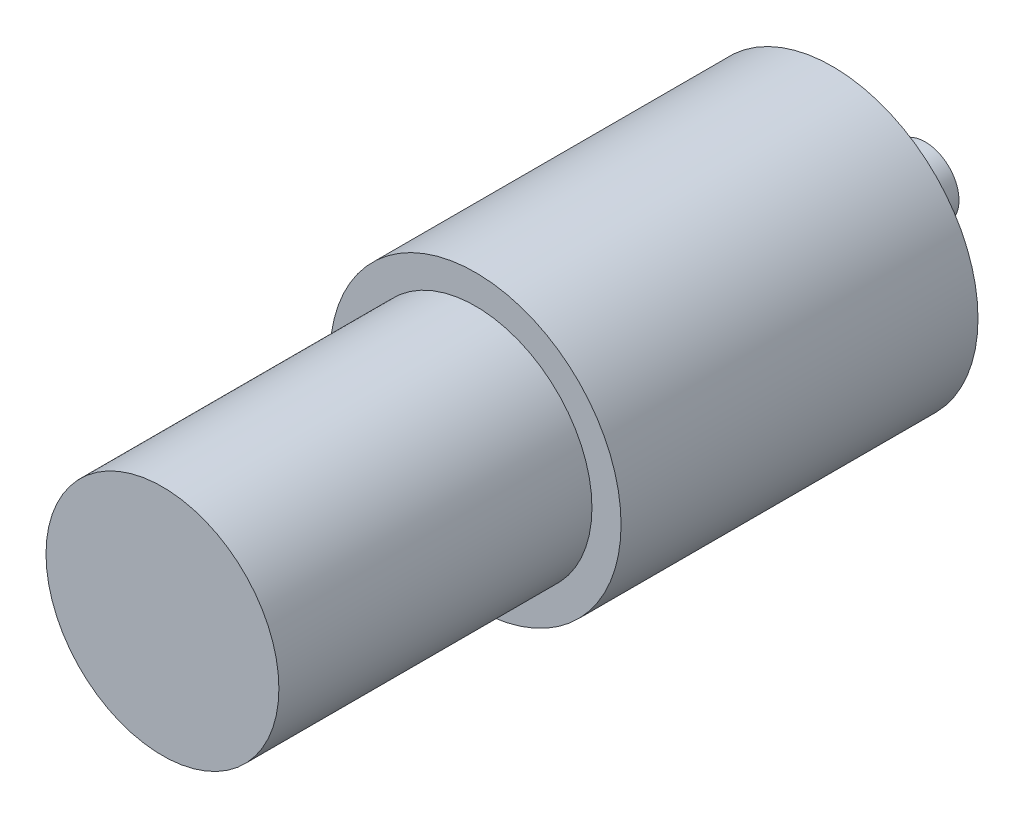
from build123d import *

# Parameters (mm, degrees)
SKETCH1_R           = 17.25
BOSS_EXTRUDE1_DEPTH = 42.3
SKETCH2_R           = 13.8
BOSS_EXTRUDE2_DEPTH = 37.1
SKETCH4_R           = 4
BOSS_EXTRUDE4_DEPTH = 11


with BuildPart() as part:
    # Sketch1 → Boss-Extrude1 (new body)
    with BuildSketch(Plane.XY):
        Circle(SKETCH1_R)
    extrude(amount=BOSS_EXTRUDE1_DEPTH)

    # Sketch2 → Boss-Extrude2 (add)
    with BuildSketch(Plane.XY.offset(42.3)):
        Circle(SKETCH2_R)
    extrude(amount=BOSS_EXTRUDE2_DEPTH)

    # Sketch4 → Boss-Extrude4 (add)
    with BuildSketch(Plane(origin=(0, 0, 0), x_dir=(-1, 0, 0), z_dir=(0, 0, -1))):
        Circle(SKETCH4_R)
    extrude(amount=BOSS_EXTRUDE4_DEPTH)


solid = part.part
